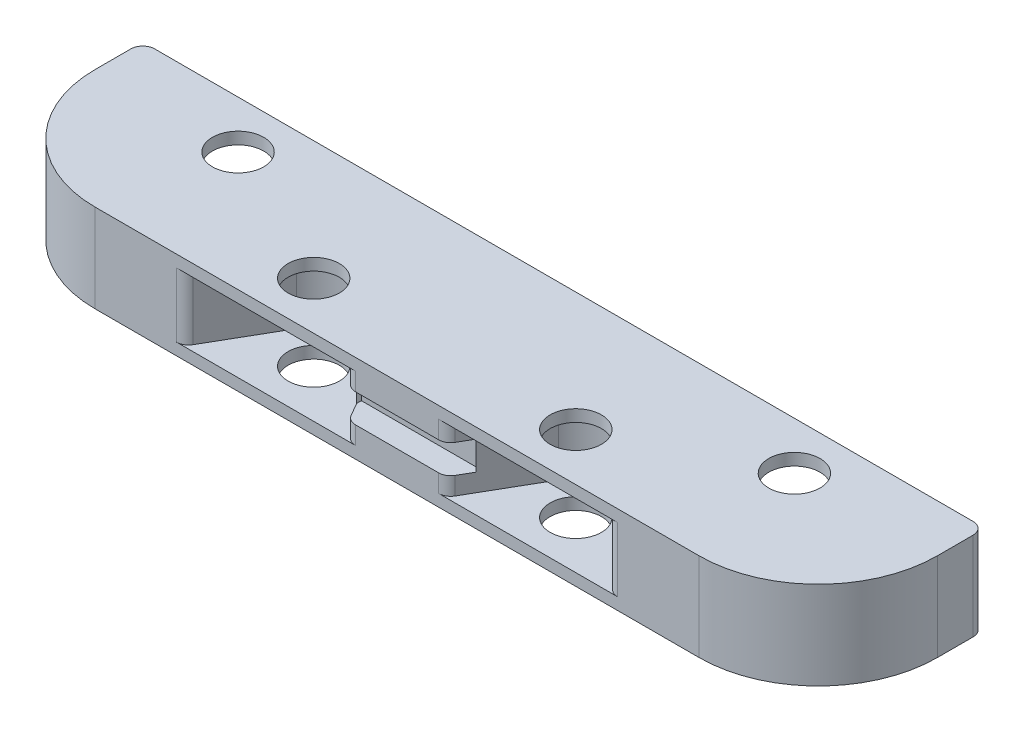
from build123d import *

# Parameters (mm, degrees)
BOSS_EXTRUDE6_DEPTH = 2.7
BOSS_EXTRUDE7_START = 2.7
SKETCH2_4_R         = 4
SKETCH2_4_R_2       = 2.15
BOSS_EXTRUDE7_DEPTH = 1
FILLET1_R           = 1
CUT_EXTRUDE1_START  = 10
SKETCH3_W           = 10
SKETCH3_H           = 2.4
CUT_EXTRUDE1_DEPTH  = 2


with BuildPart() as part:
    # Sketch2 → Boss-Extrude6 (new body)
    with BuildSketch(Plane(origin=(0, 0, 0), x_dir=(1, 0, 0), z_dir=(0, 1, 0))):
        with BuildLine():
            Line((14.35, 4), (0, 4))
            Line((0, 4), (0, -10))
            Line((0, -10), (4.07179677, -10))
            Line((4.07179677, -10), (7.535898385, -4))
            ThreePointArc((7.535898385, -4), (11, -2), (14.464101615, -4))
            Line((14.464101615, -4), (17.92820323, -10))
            Line((17.92820323, -10), (25.35, -10))
            ThreePointArc((25.35, -10), (32.421067812, -7.071067812), (35.35, 0))
            Line((35.35, 0), (35.35, 4))
            Line((35.35, 4), (32.35, 4))
            Line((32.35, 4), (32.35, 0))
            ThreePointArc((32.35, 0), (23.35, -9), (14.35, 0))
            Line((14.35, 0), (14.35, 4))
        make_face()
    extrude(amount=BOSS_EXTRUDE6_DEPTH)

    # Sketch2<4> → Boss-Extrude7 (add)
    # profile 1 of 7: a face of its own
    with BuildSketch(Plane(origin=(0, 0, 0), x_dir=(1, 0, 0), z_dir=(0, 1, 0)).offset(BOSS_EXTRUDE7_START)):
        with BuildLine():
            Line((14.35, 4), (0, 4))
            Line((0, 4), (0, -10))
            Line((0, -10), (4.07179677, -10))
            Line((4.07179677, -10), (7.535898385, -4))
            ThreePointArc((7.535898385, -4), (11, -2), (14.464101615, -4))
            Line((14.464101615, -4), (17.92820323, -10))
            Line((17.92820323, -10), (25.35, -10))
            ThreePointArc((25.35, -10), (32.421067812, -7.071067812), (35.35, 0))
            Line((35.35, 0), (35.35, 4))
            Line((35.35, 4), (32.35, 4))
            Line((32.35, 4), (32.35, 0))
            ThreePointArc((32.35, 0), (23.35, -9), (14.35, 0))
            Line((14.35, 0), (14.35, 4))
        make_face()
    # profile 2 of 7: a face of its own
    with BuildSketch(Plane(origin=(0, 0, 0), x_dir=(1, 0, 0), z_dir=(0, 1, 0)).offset(BOSS_EXTRUDE7_START)):
        with BuildLine():
            Line((7.535898385, -4), (4.07179677, -10))
            Line((4.07179677, -10), (11, -10))
            ThreePointArc((11, -10), (7.535898385, -8), (7.535898385, -4))
        make_face()
    # profile 3 of 7: a face of its own
    with BuildSketch(Plane(origin=(0, 0, 0), x_dir=(1, 0, 0), z_dir=(0, 1, 0)).offset(BOSS_EXTRUDE7_START)):
        with Locations((11, -6)):
            Circle(SKETCH2_4_R)
        with Locations(Location((11, -6, 0), (0, 0, 270))):
            Circle(SKETCH2_4_R_2, mode=Mode.SUBTRACT)
    # profile 4 of 7: a face of its own
    with BuildSketch(Plane(origin=(0, 0, 0), x_dir=(1, 0, 0), z_dir=(0, 1, 0)).offset(BOSS_EXTRUDE7_START)):
        with BuildLine():
            ThreePointArc((15, -6), (13.828427125, -8.828427125), (11, -10))
            Line((11, -10), (17.92820323, -10))
            Line((17.92820323, -10), (14.464101615, -4))
            ThreePointArc((14.464101615, -4), (14.863703305, -4.96472382), (15, -6))
        make_face()
    # profile 5 of 7: a face of its own
    with BuildSketch(Plane(origin=(0, 0, 0), x_dir=(1, 0, 0), z_dir=(0, 1, 0)).offset(BOSS_EXTRUDE7_START)):
        with BuildLine():
            Line((31.412257748, 4), (15.287742252, 4))
            ThreePointArc((15.287742252, 4), (14.587571121, 2.054224947), (14.35, 0))
            ThreePointArc((14.35, 0), (23.35, -9), (32.35, 0))
            ThreePointArc((32.35, 0), (32.112428879, 2.054224947), (31.412257748, 4))
        make_face()
        with Locations(Location((23.35, 0, 0), (0, 0, 270))):
            Circle(SKETCH2_4_R_2, mode=Mode.SUBTRACT)
    # profile 6 of 7: a face of its own
    with BuildSketch(Plane(origin=(0, 0, 0), x_dir=(1, 0, 0), z_dir=(0, 1, 0)).offset(BOSS_EXTRUDE7_START)):
        with BuildLine():
            Line((15.287742252, 4), (14.35, 4))
            Line((14.35, 4), (14.35, 0))
            ThreePointArc((14.35, 0), (14.587571121, 2.054224947), (15.287742252, 4))
        make_face()
    # profile 7 of 7: a face of its own
    with BuildSketch(Plane(origin=(0, 0, 0), x_dir=(1, 0, 0), z_dir=(0, 1, 0)).offset(BOSS_EXTRUDE7_START)):
        with BuildLine():
            Line((32.35, 4), (31.412257748, 4))
            ThreePointArc((31.412257748, 4), (32.112428879, 2.054224947), (32.35, 0))
            Line((32.35, 0), (32.35, 4))
        make_face()
    extrude(amount=BOSS_EXTRUDE7_DEPTH)

    # Mirror1: part across plane


with BuildPart() as part_1:
    add(part.part)
    add(part.part.mirror(Plane.ZX))

    # Mirror2: part across plane


with BuildPart() as part_2:
    add(part_1.part)
    add(part_1.part.mirror(Plane(origin=(0, 0, 0), x_dir=(0, 0, 1), z_dir=(1, 0, 0))))

    # Fillet1
    fillet1_edges = [part_2.edges().sort_by_distance(p)[0] for p in [
        (-35.35, 0, -4),
        (-14.35, 0, -4),
        (-32.35, 0, -4),
        (-17.92820323, 0, 10),
        (-4.07179677, 0, 10),
        (17.92820323, 0, 10),
        (4.07179677, 0, 10),
        (14.35, 0, -4),
        (32.35, 0, -4),
        (35.35, 0, -4),
    ]]
    fillet(fillet1_edges, radius=FILLET1_R)

    # Sketch3 → Cut-Extrude1 (cut)
    with BuildSketch(Plane.XY.offset(CUT_EXTRUDE1_START)):
        Rectangle(SKETCH3_W, SKETCH3_H)
    extrude(amount=-CUT_EXTRUDE1_DEPTH, mode=Mode.SUBTRACT)


solid = part_2.part
